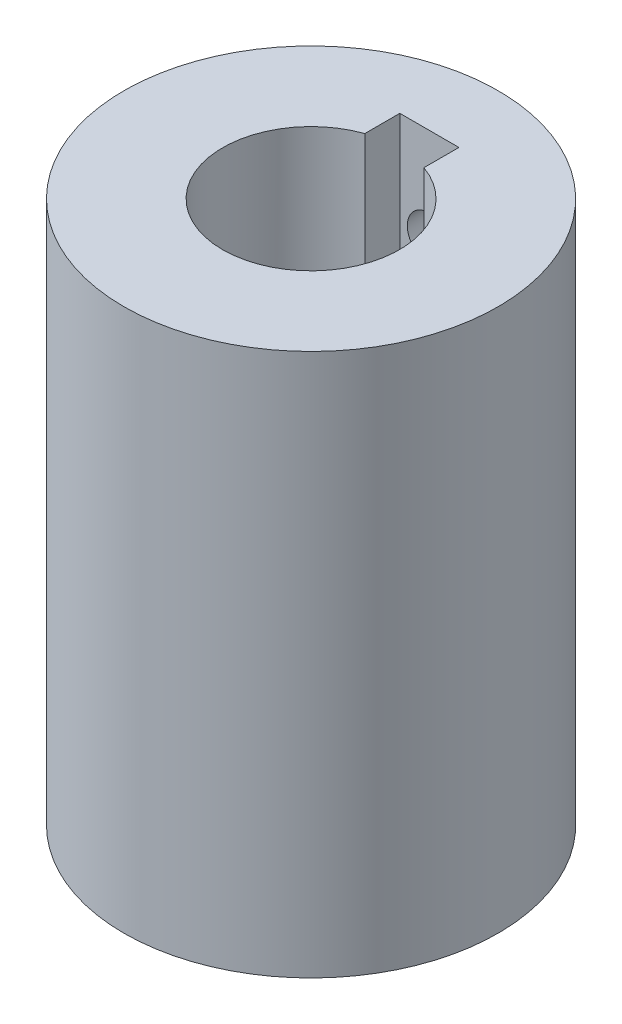
from build123d import *

# Parameters (mm, degrees)
SKETCH1_R               = 12.7
BOSS_EXTRUDE1_DEPTH     = 36.83
SKETCH3_R               = 6.35
CUT_EXTRUDE1_DEPTH      = 18.415
CUT_EXTRUDE2_REACH      = 42.976
SKETCH4_R               = 6
CUT_EXTRUDE3_DEPTH      = 18.415
BOSS_EXTRUDE2_DEPTH     = 18.415
CUT_EXTRUDE6_DEPTH      = 18.415
CUT_EXTRUDE4_REACH      = 42.976
CUT_EXTRUDE4_END_RADIUS = 12.7
SKETCH6_R               = 1.5


with BuildPart() as part:
    # Sketch1 → Boss-Extrude1 (new body)
    with BuildSketch(Plane(origin=(0, 0, 0), x_dir=(1, 0, 0), z_dir=(0, 1, 0))):
        with Locations(Location((0, 0, 0), (0, 0, 270))):
            Circle(SKETCH1_R)
    extrude(amount=BOSS_EXTRUDE1_DEPTH)

    # Sketch3 → Cut-Extrude1 (cut)
    with BuildSketch(Plane(origin=(0, 0, 0), x_dir=(-1, 0, 0), z_dir=(0, -1, 0))):
        with Locations(Location((0, 0, 0), (0, 0, 90))):
            Circle(SKETCH3_R)
    extrude(amount=-CUT_EXTRUDE1_DEPTH, mode=Mode.SUBTRACT)

    # Sketch4 → Cut-Extrude2 (cut, up to next)
    with BuildSketch(Plane(origin=(0, 36.83, 0), x_dir=(1, 0, 0), z_dir=(0, 1, 0)), mode=Mode.PRIVATE) as cut_extrude2_sk1:
        with Locations(Location((0, 0, 0), (0, 0, 270))):
            Circle(SKETCH4_R)
    cut_extrude2_tool1 = extrude(cut_extrude2_sk1.sketch, amount=-CUT_EXTRUDE2_REACH, mode=Mode.PRIVATE) & part.part
    add(cut_extrude2_tool1.solids().sort_by_distance((0, 36.83, 0))[0], mode=Mode.SUBTRACT)

    # Sketch5 → Cut-Extrude3 (cut)
    with BuildSketch(Plane(origin=(0, 36.83, 0), x_dir=(1, 0, 0), z_dir=(0, 1, 0))):
        with BuildLine():
            Line((0, 8.032), (-2.0066, 8.032))
            Line((-2.0066, 8.032), (-2.0066, 5.654516464))
            ThreePointArc((-2.0066, 5.654516464), (0, 6), (2.0066, 5.654516464))
            Line((2.0066, 5.654516464), (2.0066, 8.032))
            Line((2.0066, 8.032), (0, 8.032))
        make_face()
    extrude(amount=-CUT_EXTRUDE3_DEPTH, mode=Mode.SUBTRACT)

    # Sketch9 → Boss-Extrude2 (add)
    with BuildSketch(Plane(origin=(0, 0, 0), x_dir=(-1, 0, 0), z_dir=(0, -1, 0))):
        with BuildLine():
            Line((3.274763384, 5.440443436), (6.348943915, 0.115806564))
            ThreePointArc((6.348943915, 0.115806564), (5.499261314, 3.175), (3.274763384, 5.440443436))
        make_face()
        with BuildLine():
            ThreePointArc((3.274763384, -5.440443436), (5.499261314, -3.175), (6.348943915, -0.115806564))
            Line((6.348943915, -0.115806564), (3.274763384, -5.440443436))
        make_face()
        with BuildLine():
            ThreePointArc((-3.074180531, -5.55625), (0, -6.35), (3.074180531, -5.55625))
            Line((3.074180531, -5.55625), (-3.074180531, -5.55625))
        make_face()
        with BuildLine():
            ThreePointArc((-6.348943915, -0.115806564), (-5.499261314, -3.175), (-3.274763384, -5.440443436))
            Line((-3.274763384, -5.440443436), (-6.348943915, -0.115806564))
        make_face()
        with BuildLine():
            Line((-6.348943915, 0.115806564), (-3.274763384, 5.440443436))
            ThreePointArc((-3.274763384, 5.440443436), (-5.499261314, 3.175), (-6.348943915, 0.115806564))
        make_face()
        with BuildLine():
            Line((-3.074180531, 5.55625), (3.074180531, 5.55625))
            ThreePointArc((3.074180531, 5.55625), (0, 6.35), (-3.074180531, 5.55625))
        make_face()
    extrude(amount=-BOSS_EXTRUDE2_DEPTH)

    # Sketch9<3> → Cut-Extrude6 (cut)
    with BuildSketch(Plane(origin=(0, 0, 0), x_dir=(-1, 0, 0), z_dir=(0, -1, 0))):
        with BuildLine():
            Line((-3.207902433, -5.55625), (-3.074180531, -5.55625))
            ThreePointArc((-3.074180531, -5.55625), (-3.175, -5.499261314), (-3.274763384, -5.440443436))
            Line((-3.274763384, -5.440443436), (-3.207902433, -5.55625))
        make_face()
        with BuildLine():
            ThreePointArc((-6.348943915, -0.115806564), (-6.35, 0), (-6.348943915, 0.115806564))
            Line((-6.348943915, 0.115806564), (-6.415804866, 0))
            Line((-6.415804866, 0), (-6.348943915, -0.115806564))
        make_face()
        with BuildLine():
            ThreePointArc((-3.274763384, 5.440443436), (-3.175, 5.499261314), (-3.074180531, 5.55625))
            Line((-3.074180531, 5.55625), (-3.207902433, 5.55625))
            Line((-3.207902433, 5.55625), (-3.274763384, 5.440443436))
        make_face()
        with BuildLine():
            ThreePointArc((3.074180531, 5.55625), (3.175, 5.499261314), (3.274763384, 5.440443436))
            Line((3.274763384, 5.440443436), (3.207902433, 5.55625))
            Line((3.207902433, 5.55625), (3.074180531, 5.55625))
        make_face()
        with BuildLine():
            Line((6.348943915, -0.115806564), (6.415804866, 0))
            Line((6.415804866, 0), (6.348943915, 0.115806564))
            ThreePointArc((6.348943915, 0.115806564), (6.349735973, 0.05790569), (6.35, 0))
            ThreePointArc((6.35, 0), (6.349735973, -0.05790569), (6.348943915, -0.115806564))
        make_face()
        with BuildLine():
            Line((3.207902433, -5.55625), (3.274763384, -5.440443436))
            ThreePointArc((3.274763384, -5.440443436), (3.175, -5.499261314), (3.074180531, -5.55625))
            Line((3.074180531, -5.55625), (3.207902433, -5.55625))
        make_face()
    extrude(amount=-CUT_EXTRUDE6_DEPTH, mode=Mode.SUBTRACT)

    # Cut-Extrude4: up to this cylinder (the profile starts inside it)
    cut_extrude4_end = Plane(origin=(0, 18.415, 0), z_dir=(0, -1, 0)) * Cylinder(CUT_EXTRUDE4_END_RADIUS, 136.482, mode=Mode.PRIVATE)
    # Sketch6 → Cut-Extrude4 (cut, up to the surface)
    with BuildSketch(Plane.XY, mode=Mode.PRIVATE) as cut_extrude4_sk1:
        with Locations((0, 30.48)):
            Circle(SKETCH6_R)
    cut_extrude4_tool1 = extrude(cut_extrude4_sk1.sketch, amount=-CUT_EXTRUDE4_REACH, mode=Mode.PRIVATE) & cut_extrude4_end
    add(cut_extrude4_tool1.solids().sort_by_distance((0, 30.48, 0))[0], mode=Mode.SUBTRACT)
    # Sketch6 → Cut-Extrude4 (cut, up to the surface)
    with BuildSketch(Plane.XY, mode=Mode.PRIVATE) as cut_extrude4_sk2:
        with Locations((0, 6.35)):
            Circle(SKETCH6_R)
    cut_extrude4_tool2 = extrude(cut_extrude4_sk2.sketch, amount=-CUT_EXTRUDE4_REACH, mode=Mode.PRIVATE) & cut_extrude4_end
    add(cut_extrude4_tool2.solids().sort_by_distance((0, 6.35, 0))[0], mode=Mode.SUBTRACT)


solid = part.part
